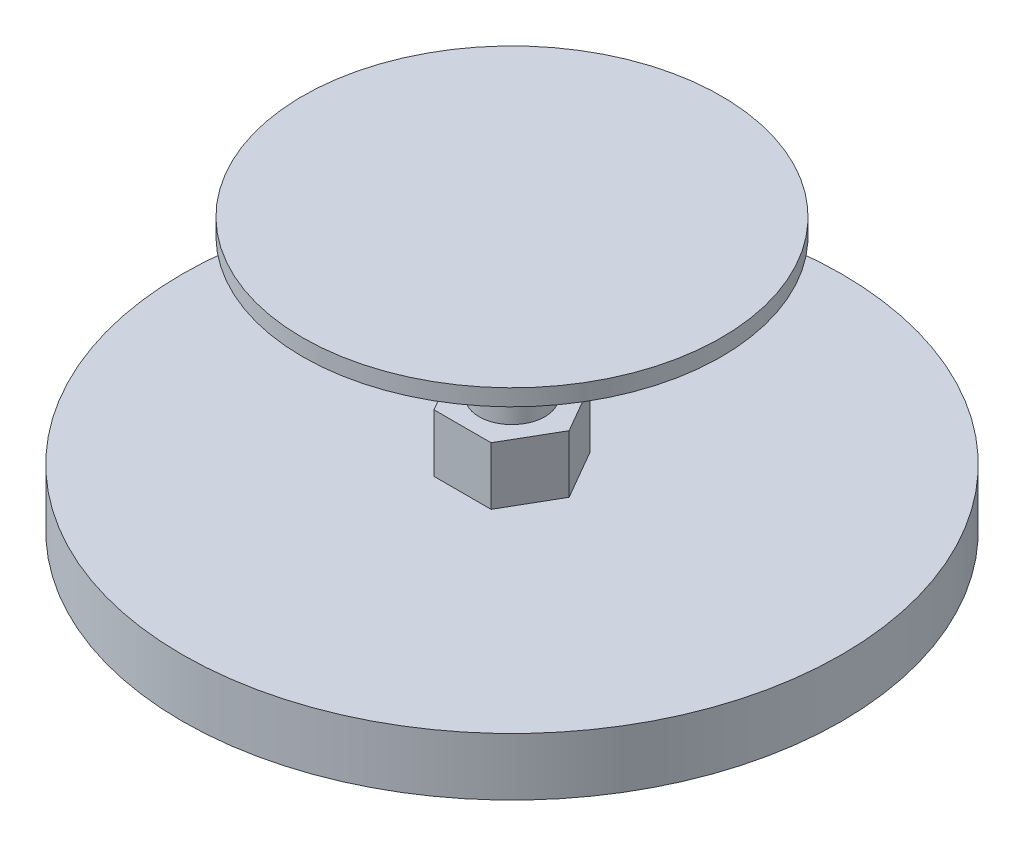
from build123d import *

# Parameters (mm, degrees)
ESBO_O2_R                = 40
RESSALTO_EXTRUS_O1_DEPTH = 7
RESSALTO_EXTRUS_O2_DEPTH = 7
ESBO_O4_R                = 4
RESSALTO_EXTRUS_O3_DEPTH = 10
RESSALTO_EXTRUS_O4_DEPTH = 7
ESBO_O6_R                = 25.4
RESSALTO_EXTRUS_O5_DEPTH = 2


with BuildPart() as part:
    # Esboço2 → Ressalto-extrusão1 (new body)
    with BuildSketch(Plane(origin=(0, 0, 0), x_dir=(1, 0, 0), z_dir=(0, 1, 0))):
        with Locations(Location((0, 0, 0), (0, 0, 270))):
            Circle(ESBO_O2_R)
    extrude(amount=RESSALTO_EXTRUS_O1_DEPTH)

    # Esboço3 → Ressalto-extrusão2 (add)
    with BuildSketch(Plane(origin=(0, 7, 0), x_dir=(1, 0, 0), z_dir=(0, 1, 0))):
        Polygon((6.92820323, 0), (3.464101615, 6), (-3.464101615, 6), (-6.92820323, 0), (-3.464101615, -6), (3.464101615, -6), align=None)
    extrude(amount=RESSALTO_EXTRUS_O2_DEPTH)

    # Esboço4 → Ressalto-extrusão3 (add)
    with BuildSketch(Plane(origin=(0, 14, 0), x_dir=(1, 0, 0), z_dir=(0, 1, 0))):
        with Locations(Location((0, 0, 0), (0, 0, 270))):
            Circle(ESBO_O4_R)
    extrude(amount=RESSALTO_EXTRUS_O3_DEPTH)

    # Esboço5 → Ressalto-extrusão4 (add)
    with BuildSketch(Plane(origin=(0, 24, 0), x_dir=(1, 0, 0), z_dir=(0, 1, 0))):
        Polygon((6.92820323, 0), (3.464101615, 6), (-3.464101615, 6), (-6.92820323, 0), (-3.464101615, -6), (3.464101615, -6), align=None)
    extrude(amount=RESSALTO_EXTRUS_O4_DEPTH)

    # Esboço6 → Ressalto-extrusão5 (add)
    with BuildSketch(Plane(origin=(0, 31, 0), x_dir=(1, 0, 0), z_dir=(0, 1, 0))):
        with Locations(Location((0, 0, 0), (0, 0, 270))):
            Circle(ESBO_O6_R)
    extrude(amount=RESSALTO_EXTRUS_O5_DEPTH)


solid = part.part
